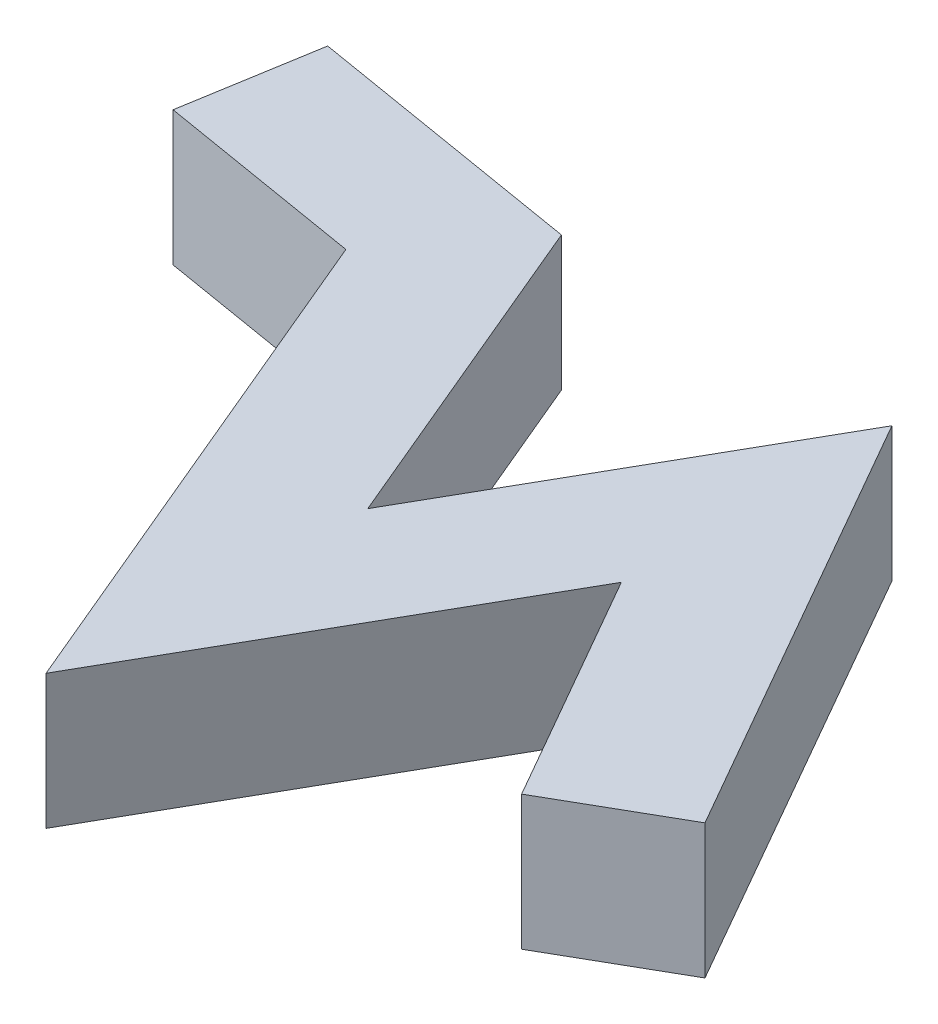
from build123d import *

# Parameters (mm, degrees)
EXTRU_MINCE1_DEPTH = 10


with BuildPart() as part:
    # Esquisse1 → Extru.-Mince1 (new body)
    with BuildSketch(Plane(origin=(0, 0, 0), x_dir=(1, 0, 0), z_dir=(0, 1, 0))):
        Polygon((-104.374362654, 23.981252372), (-83.499490124, 20.50210695), (-73.062053858, -4.348931777), (-58.896961784, 20.50210695), (-40.258682738, -12.052753783), (-48.937034492, -17.021275779), (-58.877816911, 0.341957511), (-74.423621482, -26.931383841), (-90.58364466, 11.544861822), (-106.018352527, 14.117313133), align=None)
    extrude(amount=EXTRU_MINCE1_DEPTH)


solid = part.part
